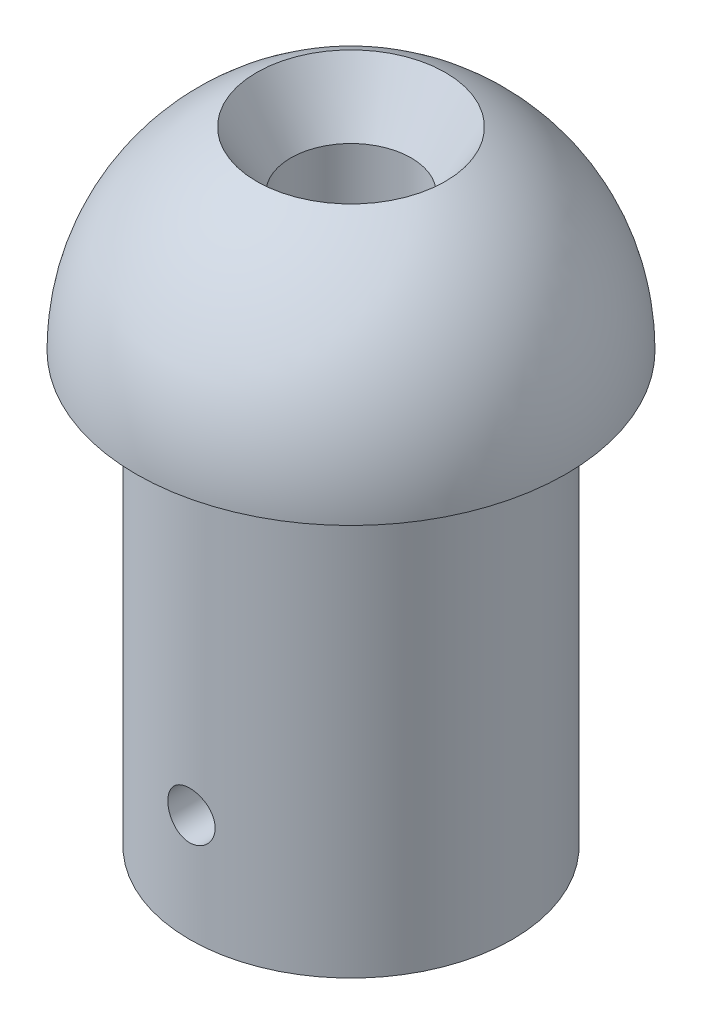
from build123d import *

# Parameters (mm, degrees)
SKETCH3_R           = 9.525
BOSS_EXTRUDE1_DEPTH = 25.4
SKETCH5_R           = 3.556
CUT_EXTRUDE1_DEPTH  = 43.121134838
SKETCH6_R           = 6.35
CUT_EXTRUDE2_DEPTH  = 5.08
CUT_EXTRUDE2_DRAFT  = -31
SKETCH7_R           = 1.397
CUT_EXTRUDE3_DEPTH  = 39.1


with BuildPart() as part:
    # Sketch2 → Revolve2 (revolve)
    with BuildSketch(Plane.XY):
        with BuildLine():
            Line((12.7, 0), (0, 0))
            Line((0, 0), (0, 12.7))
            ThreePointArc((0, 12.7), (8.980256121, 8.980256121), (12.7, 0))
        make_face()
    revolve(axis=Axis((0, 67.537553081, 0), (0, -1, 0)))

    # Sketch3 → Boss-Extrude1 (add)
    with BuildSketch(Plane.XZ):
        with Locations(Location((0, 0, 0), (0, 0, 90))):
            Circle(SKETCH3_R)
    extrude(amount=BOSS_EXTRUDE1_DEPTH)

    # Sketch5 → Cut-Extrude1 (cut, through all)
    with BuildSketch(Plane.XZ.offset(25.4)):
        with Locations(Location((0, 0, 0), (0, 0, 270))):
            Circle(SKETCH5_R)
    extrude(amount=-CUT_EXTRUDE1_DEPTH, mode=Mode.SUBTRACT)


with BuildPart() as cut_extrude2_tool:
    # Sketch6 → Cut-Extrude2 (with draft: the straight prism first)
    with BuildSketch(Plane(origin=(0, 12.7, 0), x_dir=(1, 0, 0), z_dir=(0, 1, 0))):
        Circle(SKETCH6_R)
    extrude(amount=-CUT_EXTRUDE2_DEPTH)
    # Cut-Extrude2: the draft: its side faces are tilted about the plane it starts from
    cut_extrude2_sides = [cut_extrude2_tool.faces().sort_by_distance(p)[0] for p in [
        (-6.35, 10.16, 0),
    ]]
    draft(cut_extrude2_sides, Plane(origin=(0, 12.7, 0), x_dir=(1, 0, 0), z_dir=(0, 1, 0)), CUT_EXTRUDE2_DRAFT)


with BuildPart() as part_1:
    add(part.part)

    # Cut-Extrude2: cut by cut_extrude2_tool
    add(cut_extrude2_tool.part, mode=Mode.SUBTRACT)

    # Sketch7 → Cut-Extrude3 (cut, through all)
    with BuildSketch(Plane.XY.offset(12.7)):
        with Locations((0, -19.05)):
            Circle(SKETCH7_R)
    extrude(amount=-CUT_EXTRUDE3_DEPTH, mode=Mode.SUBTRACT)


solid = part_1.part
